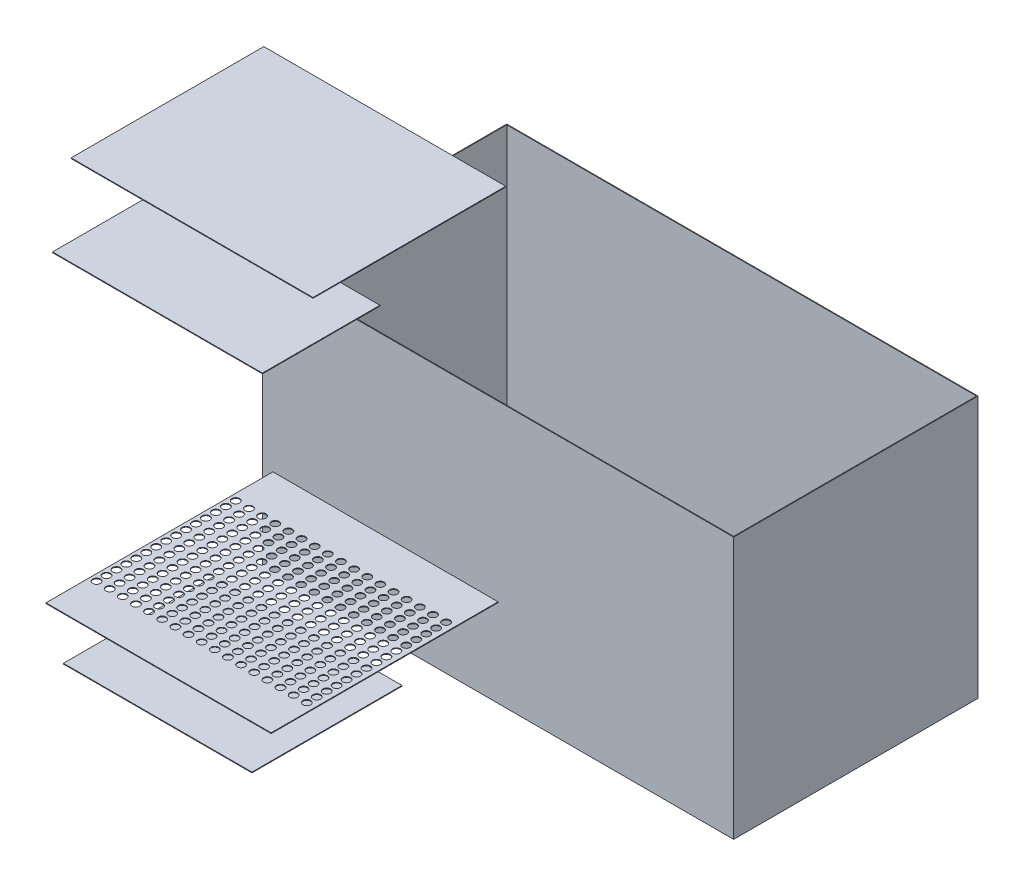
from build123d import *

# Parameters (mm, degrees)
MASTER_FOOTPRINT_W            = 1350
MASTER_FOOTPRINT_H            = 700
BATH_BASE_PLATE_DEPTH         = 750
BATH_SHELL_2MM_T              = -2
INLET_IMPACT_BAFFLE_START     = 125
SKETCH_1_W                    = 540
SKETCH_1_H                    = 430
INLET_IMPACT_BAFFLE_DEPTH     = 2
DISTRIBUTOR_D22_START         = 250
SKETCH_2_W                    = 645
SKETCH_2_H                    = 652
SKETCH_2_R                    = 11
DISTRIBUTOR_D22_DEPTH         = 2
OUTLET_SUBMERGED_BAFFLE_START = 1130
SKETCH_3_W                    = 601.176470588
SKETCH_3_H                    = 336.5
OUTLET_SUBMERGED_BAFFLE_DEPTH = 2
OVERFLOW_WEIR_Z550_START      = 1290
SKETCH_4_W                    = 693
SKETCH_4_H                    = 552
OVERFLOW_WEIR_Z550_DEPTH      = 2


with BuildPart() as part:
    # MASTER_FOOTPRINT → BATH_BASE_PLATE (new body)
    with BuildSketch(Plane(origin=(0, 0, 0), x_dir=(1, 0, 0), z_dir=(0, 1, 0))):
        with Locations((675, 350)):
            Rectangle(MASTER_FOOTPRINT_W, MASTER_FOOTPRINT_H)
    extrude(amount=BATH_BASE_PLATE_DEPTH)

    # BATH_SHELL_2MM
    bath_shell_2mm_openings = [part.faces().sort_by_distance(p)[0] for p in [
        (675, 750, -350),
    ]]
    offset(amount=BATH_SHELL_2MM_T, openings=bath_shell_2mm_openings, kind=Kind.INTERSECTION)


with BuildPart() as body_2:
    # Эскиз1 → INLET_IMPACT_BAFFLE (new body)
    with BuildSketch(Plane(origin=(0, 0, 0), x_dir=(1, 0, 0), z_dir=(0, 1, 0)).offset(INLET_IMPACT_BAFFLE_START)):
        with Locations((350, -435)):
            Rectangle(SKETCH_1_W, SKETCH_1_H)
    extrude(amount=INLET_IMPACT_BAFFLE_DEPTH)


with BuildPart() as body_3:
    # Эскиз2 → DISTRIBUTOR_D22 (new body)
    with BuildSketch(Plane(origin=(0, 0, 0), x_dir=(1, 0, 0), z_dir=(0, 1, 0)).offset(DISTRIBUTOR_D22_START)):
        with Locations((352.5, -324)):
            Rectangle(SKETCH_2_W, SKETCH_2_H)
        with Locations(Location((48.823529412, -125, 0), (0, 0, 270))):
            Circle(SKETCH_2_R, mode=Mode.SUBTRACT)
        with Locations(Location((48.823529412, -153.5, 0), (0, 0, 270))):
            Circle(SKETCH_2_R, mode=Mode.SUBTRACT)
        with Locations(Location((48.823529412, -182, 0), (0, 0, 270))):
            Circle(SKETCH_2_R, mode=Mode.SUBTRACT)
        with Locations(Location((48.823529412, -210.5, 0), (0, 0, 270))):
            Circle(SKETCH_2_R, mode=Mode.SUBTRACT)
        with Locations(Location((48.823529412, -239, 0), (0, 0, 270))):
            Circle(SKETCH_2_R, mode=Mode.SUBTRACT)
        with Locations(Location((48.823529412, -267.5, 0), (0, 0, 270))):
            Circle(SKETCH_2_R, mode=Mode.SUBTRACT)
        with Locations(Location((48.823529412, -296, 0), (0, 0, 270))):
            Circle(SKETCH_2_R, mode=Mode.SUBTRACT)
        with Locations(Location((48.823529412, -324.5, 0), (0, 0, 270))):
            Circle(SKETCH_2_R, mode=Mode.SUBTRACT)
        with Locations(Location((48.823529412, -353, 0), (0, 0, 270))):
            Circle(SKETCH_2_R, mode=Mode.SUBTRACT)
        with Locations(Location((48.823529412, -381.5, 0), (0, 0, 270))):
            Circle(SKETCH_2_R, mode=Mode.SUBTRACT)
        with Locations(Location((48.823529412, -410, 0), (0, 0, 270))):
            Circle(SKETCH_2_R, mode=Mode.SUBTRACT)
        with Locations(Location((48.823529412, -438.5, 0), (0, 0, 270))):
            Circle(SKETCH_2_R, mode=Mode.SUBTRACT)
        with Locations(Location((48.823529412, -467, 0), (0, 0, 270))):
            Circle(SKETCH_2_R, mode=Mode.SUBTRACT)
        with Locations(Location((48.823529412, -495.5, 0), (0, 0, 270))):
            Circle(SKETCH_2_R, mode=Mode.SUBTRACT)
        with Locations(Location((48.823529412, -524, 0), (0, 0, 270))):
            Circle(SKETCH_2_R, mode=Mode.SUBTRACT)
        with Locations(Location((86.470588235, -125, 0), (0, 0, 270))):
            Circle(SKETCH_2_R, mode=Mode.SUBTRACT)
        with Locations(Location((86.470588235, -153.5, 0), (0, 0, 270))):
            Circle(SKETCH_2_R, mode=Mode.SUBTRACT)
        with Locations(Location((86.470588235, -182, 0), (0, 0, 270))):
            Circle(SKETCH_2_R, mode=Mode.SUBTRACT)
        with Locations(Location((86.470588235, -210.5, 0), (0, 0, 270))):
            Circle(SKETCH_2_R, mode=Mode.SUBTRACT)
        with Locations(Location((86.470588235, -239, 0), (0, 0, 270))):
            Circle(SKETCH_2_R, mode=Mode.SUBTRACT)
        with Locations(Location((86.470588235, -267.5, 0), (0, 0, 270))):
            Circle(SKETCH_2_R, mode=Mode.SUBTRACT)
        with Locations(Location((86.470588235, -296, 0), (0, 0, 270))):
            Circle(SKETCH_2_R, mode=Mode.SUBTRACT)
        with Locations(Location((86.470588235, -324.5, 0), (0, 0, 270))):
            Circle(SKETCH_2_R, mode=Mode.SUBTRACT)
        with Locations(Location((86.470588235, -353, 0), (0, 0, 270))):
            Circle(SKETCH_2_R, mode=Mode.SUBTRACT)
        with Locations(Location((86.470588235, -381.5, 0), (0, 0, 270))):
            Circle(SKETCH_2_R, mode=Mode.SUBTRACT)
        with Locations(Location((86.470588235, -410, 0), (0, 0, 270))):
            Circle(SKETCH_2_R, mode=Mode.SUBTRACT)
        with Locations(Location((86.470588235, -438.5, 0), (0, 0, 270))):
            Circle(SKETCH_2_R, mode=Mode.SUBTRACT)
        with Locations(Location((86.470588235, -467, 0), (0, 0, 270))):
            Circle(SKETCH_2_R, mode=Mode.SUBTRACT)
        with Locations(Location((86.470588235, -495.5, 0), (0, 0, 270))):
            Circle(SKETCH_2_R, mode=Mode.SUBTRACT)
        with Locations(Location((86.470588235, -524, 0), (0, 0, 270))):
            Circle(SKETCH_2_R, mode=Mode.SUBTRACT)
        with Locations(Location((124.117647059, -125, 0), (0, 0, 270))):
            Circle(SKETCH_2_R, mode=Mode.SUBTRACT)
        with Locations(Location((124.117647059, -153.5, 0), (0, 0, 270))):
            Circle(SKETCH_2_R, mode=Mode.SUBTRACT)
        with Locations(Location((124.117647059, -182, 0), (0, 0, 270))):
            Circle(SKETCH_2_R, mode=Mode.SUBTRACT)
        with Locations(Location((124.117647059, -210.5, 0), (0, 0, 270))):
            Circle(SKETCH_2_R, mode=Mode.SUBTRACT)
        with Locations(Location((124.117647059, -239, 0), (0, 0, 270))):
            Circle(SKETCH_2_R, mode=Mode.SUBTRACT)
        with Locations(Location((124.117647059, -267.5, 0), (0, 0, 270))):
            Circle(SKETCH_2_R, mode=Mode.SUBTRACT)
        with Locations(Location((124.117647059, -296, 0), (0, 0, 270))):
            Circle(SKETCH_2_R, mode=Mode.SUBTRACT)
        with Locations(Location((124.117647059, -324.5, 0), (0, 0, 270))):
            Circle(SKETCH_2_R, mode=Mode.SUBTRACT)
        with Locations(Location((124.117647059, -353, 0), (0, 0, 270))):
            Circle(SKETCH_2_R, mode=Mode.SUBTRACT)
        with Locations(Location((124.117647059, -381.5, 0), (0, 0, 270))):
            Circle(SKETCH_2_R, mode=Mode.SUBTRACT)
        with Locations(Location((124.117647059, -410, 0), (0, 0, 270))):
            Circle(SKETCH_2_R, mode=Mode.SUBTRACT)
        with Locations(Location((124.117647059, -438.5, 0), (0, 0, 270))):
            Circle(SKETCH_2_R, mode=Mode.SUBTRACT)
        with Locations(Location((124.117647059, -467, 0), (0, 0, 270))):
            Circle(SKETCH_2_R, mode=Mode.SUBTRACT)
        with Locations(Location((124.117647059, -495.5, 0), (0, 0, 270))):
            Circle(SKETCH_2_R, mode=Mode.SUBTRACT)
        with Locations(Location((124.117647059, -524, 0), (0, 0, 270))):
            Circle(SKETCH_2_R, mode=Mode.SUBTRACT)
        with Locations(Location((161.764705882, -125, 0), (0, 0, 270))):
            Circle(SKETCH_2_R, mode=Mode.SUBTRACT)
        with Locations(Location((161.764705882, -153.5, 0), (0, 0, 270))):
            Circle(SKETCH_2_R, mode=Mode.SUBTRACT)
        with Locations(Location((161.764705882, -182, 0), (0, 0, 270))):
            Circle(SKETCH_2_R, mode=Mode.SUBTRACT)
        with Locations(Location((161.764705882, -210.5, 0), (0, 0, 270))):
            Circle(SKETCH_2_R, mode=Mode.SUBTRACT)
        with Locations(Location((161.764705882, -239, 0), (0, 0, 270))):
            Circle(SKETCH_2_R, mode=Mode.SUBTRACT)
        with Locations(Location((161.764705882, -267.5, 0), (0, 0, 270))):
            Circle(SKETCH_2_R, mode=Mode.SUBTRACT)
        with Locations(Location((161.764705882, -296, 0), (0, 0, 270))):
            Circle(SKETCH_2_R, mode=Mode.SUBTRACT)
        with Locations(Location((161.764705882, -324.5, 0), (0, 0, 270))):
            Circle(SKETCH_2_R, mode=Mode.SUBTRACT)
        with Locations(Location((161.764705882, -353, 0), (0, 0, 270))):
            Circle(SKETCH_2_R, mode=Mode.SUBTRACT)
        with Locations(Location((161.764705882, -381.5, 0), (0, 0, 270))):
            Circle(SKETCH_2_R, mode=Mode.SUBTRACT)
        with Locations(Location((161.764705882, -410, 0), (0, 0, 270))):
            Circle(SKETCH_2_R, mode=Mode.SUBTRACT)
        with Locations(Location((161.764705882, -438.5, 0), (0, 0, 270))):
            Circle(SKETCH_2_R, mode=Mode.SUBTRACT)
        with Locations(Location((161.764705882, -467, 0), (0, 0, 270))):
            Circle(SKETCH_2_R, mode=Mode.SUBTRACT)
        with Locations(Location((161.764705882, -495.5, 0), (0, 0, 270))):
            Circle(SKETCH_2_R, mode=Mode.SUBTRACT)
        with Locations(Location((161.764705882, -524, 0), (0, 0, 270))):
            Circle(SKETCH_2_R, mode=Mode.SUBTRACT)
        with Locations(Location((199.411764706, -125, 0), (0, 0, 270))):
            Circle(SKETCH_2_R, mode=Mode.SUBTRACT)
        with Locations(Location((199.411764706, -153.5, 0), (0, 0, 270))):
            Circle(SKETCH_2_R, mode=Mode.SUBTRACT)
        with Locations(Location((199.411764706, -182, 0), (0, 0, 270))):
            Circle(SKETCH_2_R, mode=Mode.SUBTRACT)
        with Locations(Location((199.411764706, -210.5, 0), (0, 0, 270))):
            Circle(SKETCH_2_R, mode=Mode.SUBTRACT)
        with Locations(Location((199.411764706, -239, 0), (0, 0, 270))):
            Circle(SKETCH_2_R, mode=Mode.SUBTRACT)
        with Locations(Location((199.411764706, -267.5, 0), (0, 0, 270))):
            Circle(SKETCH_2_R, mode=Mode.SUBTRACT)
        with Locations(Location((199.411764706, -296, 0), (0, 0, 270))):
            Circle(SKETCH_2_R, mode=Mode.SUBTRACT)
        with Locations(Location((199.411764706, -324.5, 0), (0, 0, 270))):
            Circle(SKETCH_2_R, mode=Mode.SUBTRACT)
        with Locations(Location((199.411764706, -353, 0), (0, 0, 270))):
            Circle(SKETCH_2_R, mode=Mode.SUBTRACT)
        with Locations(Location((199.411764706, -381.5, 0), (0, 0, 270))):
            Circle(SKETCH_2_R, mode=Mode.SUBTRACT)
        with Locations(Location((199.411764706, -410, 0), (0, 0, 270))):
            Circle(SKETCH_2_R, mode=Mode.SUBTRACT)
        with Locations(Location((199.411764706, -438.5, 0), (0, 0, 270))):
            Circle(SKETCH_2_R, mode=Mode.SUBTRACT)
        with Locations(Location((199.411764706, -467, 0), (0, 0, 270))):
            Circle(SKETCH_2_R, mode=Mode.SUBTRACT)
        with Locations(Location((199.411764706, -495.5, 0), (0, 0, 270))):
            Circle(SKETCH_2_R, mode=Mode.SUBTRACT)
        with Locations(Location((199.411764706, -524, 0), (0, 0, 270))):
            Circle(SKETCH_2_R, mode=Mode.SUBTRACT)
        with Locations(Location((237.058823529, -125, 0), (0, 0, 270))):
            Circle(SKETCH_2_R, mode=Mode.SUBTRACT)
        with Locations(Location((237.058823529, -153.5, 0), (0, 0, 270))):
            Circle(SKETCH_2_R, mode=Mode.SUBTRACT)
        with Locations(Location((237.058823529, -182, 0), (0, 0, 270))):
            Circle(SKETCH_2_R, mode=Mode.SUBTRACT)
        with Locations(Location((237.058823529, -210.5, 0), (0, 0, 270))):
            Circle(SKETCH_2_R, mode=Mode.SUBTRACT)
        with Locations(Location((237.058823529, -239, 0), (0, 0, 270))):
            Circle(SKETCH_2_R, mode=Mode.SUBTRACT)
        with Locations(Location((237.058823529, -267.5, 0), (0, 0, 270))):
            Circle(SKETCH_2_R, mode=Mode.SUBTRACT)
        with Locations(Location((237.058823529, -296, 0), (0, 0, 270))):
            Circle(SKETCH_2_R, mode=Mode.SUBTRACT)
        with Locations(Location((237.058823529, -324.5, 0), (0, 0, 270))):
            Circle(SKETCH_2_R, mode=Mode.SUBTRACT)
        with Locations(Location((237.058823529, -353, 0), (0, 0, 270))):
            Circle(SKETCH_2_R, mode=Mode.SUBTRACT)
        with Locations(Location((237.058823529, -381.5, 0), (0, 0, 270))):
            Circle(SKETCH_2_R, mode=Mode.SUBTRACT)
        with Locations(Location((237.058823529, -410, 0), (0, 0, 270))):
            Circle(SKETCH_2_R, mode=Mode.SUBTRACT)
        with Locations(Location((237.058823529, -438.5, 0), (0, 0, 270))):
            Circle(SKETCH_2_R, mode=Mode.SUBTRACT)
        with Locations(Location((237.058823529, -467, 0), (0, 0, 270))):
            Circle(SKETCH_2_R, mode=Mode.SUBTRACT)
        with Locations(Location((237.058823529, -495.5, 0), (0, 0, 270))):
            Circle(SKETCH_2_R, mode=Mode.SUBTRACT)
        with Locations(Location((237.058823529, -524, 0), (0, 0, 270))):
            Circle(SKETCH_2_R, mode=Mode.SUBTRACT)
        with Locations(Location((274.705882353, -125, 0), (0, 0, 270))):
            Circle(SKETCH_2_R, mode=Mode.SUBTRACT)
        with Locations(Location((274.705882353, -153.5, 0), (0, 0, 270))):
            Circle(SKETCH_2_R, mode=Mode.SUBTRACT)
        with Locations(Location((274.705882353, -182, 0), (0, 0, 270))):
            Circle(SKETCH_2_R, mode=Mode.SUBTRACT)
        with Locations(Location((274.705882353, -210.5, 0), (0, 0, 270))):
            Circle(SKETCH_2_R, mode=Mode.SUBTRACT)
        with Locations(Location((274.705882353, -239, 0), (0, 0, 270))):
            Circle(SKETCH_2_R, mode=Mode.SUBTRACT)
        with Locations(Location((274.705882353, -267.5, 0), (0, 0, 270))):
            Circle(SKETCH_2_R, mode=Mode.SUBTRACT)
        with Locations(Location((274.705882353, -296, 0), (0, 0, 270))):
            Circle(SKETCH_2_R, mode=Mode.SUBTRACT)
        with Locations(Location((274.705882353, -324.5, 0), (0, 0, 270))):
            Circle(SKETCH_2_R, mode=Mode.SUBTRACT)
        with Locations(Location((274.705882353, -353, 0), (0, 0, 270))):
            Circle(SKETCH_2_R, mode=Mode.SUBTRACT)
        with Locations(Location((274.705882353, -381.5, 0), (0, 0, 270))):
            Circle(SKETCH_2_R, mode=Mode.SUBTRACT)
        with Locations(Location((274.705882353, -410, 0), (0, 0, 270))):
            Circle(SKETCH_2_R, mode=Mode.SUBTRACT)
        with Locations(Location((274.705882353, -438.5, 0), (0, 0, 270))):
            Circle(SKETCH_2_R, mode=Mode.SUBTRACT)
        with Locations(Location((274.705882353, -467, 0), (0, 0, 270))):
            Circle(SKETCH_2_R, mode=Mode.SUBTRACT)
        with Locations(Location((274.705882353, -495.5, 0), (0, 0, 270))):
            Circle(SKETCH_2_R, mode=Mode.SUBTRACT)
        with Locations(Location((274.705882353, -524, 0), (0, 0, 270))):
            Circle(SKETCH_2_R, mode=Mode.SUBTRACT)
        with Locations(Location((312.352941176, -125, 0), (0, 0, 270))):
            Circle(SKETCH_2_R, mode=Mode.SUBTRACT)
        with Locations(Location((312.352941176, -153.5, 0), (0, 0, 270))):
            Circle(SKETCH_2_R, mode=Mode.SUBTRACT)
        with Locations(Location((312.352941176, -182, 0), (0, 0, 270))):
            Circle(SKETCH_2_R, mode=Mode.SUBTRACT)
        with Locations(Location((312.352941176, -210.5, 0), (0, 0, 270))):
            Circle(SKETCH_2_R, mode=Mode.SUBTRACT)
        with Locations(Location((312.352941176, -239, 0), (0, 0, 270))):
            Circle(SKETCH_2_R, mode=Mode.SUBTRACT)
        with Locations(Location((312.352941176, -267.5, 0), (0, 0, 270))):
            Circle(SKETCH_2_R, mode=Mode.SUBTRACT)
        with Locations(Location((312.352941176, -296, 0), (0, 0, 270))):
            Circle(SKETCH_2_R, mode=Mode.SUBTRACT)
        with Locations(Location((312.352941176, -324.5, 0), (0, 0, 270))):
            Circle(SKETCH_2_R, mode=Mode.SUBTRACT)
        with Locations(Location((312.352941176, -353, 0), (0, 0, 270))):
            Circle(SKETCH_2_R, mode=Mode.SUBTRACT)
        with Locations(Location((312.352941176, -381.5, 0), (0, 0, 270))):
            Circle(SKETCH_2_R, mode=Mode.SUBTRACT)
        with Locations(Location((312.352941176, -410, 0), (0, 0, 270))):
            Circle(SKETCH_2_R, mode=Mode.SUBTRACT)
        with Locations(Location((312.352941176, -438.5, 0), (0, 0, 270))):
            Circle(SKETCH_2_R, mode=Mode.SUBTRACT)
        with Locations(Location((312.352941176, -467, 0), (0, 0, 270))):
            Circle(SKETCH_2_R, mode=Mode.SUBTRACT)
        with Locations(Location((312.352941176, -495.5, 0), (0, 0, 270))):
            Circle(SKETCH_2_R, mode=Mode.SUBTRACT)
        with Locations(Location((312.352941176, -524, 0), (0, 0, 270))):
            Circle(SKETCH_2_R, mode=Mode.SUBTRACT)
        with Locations(Location((350, -125, 0), (0, 0, 270))):
            Circle(SKETCH_2_R, mode=Mode.SUBTRACT)
        with Locations(Location((350, -153.5, 0), (0, 0, 270))):
            Circle(SKETCH_2_R, mode=Mode.SUBTRACT)
        with Locations(Location((350, -182, 0), (0, 0, 270))):
            Circle(SKETCH_2_R, mode=Mode.SUBTRACT)
        with Locations(Location((350, -210.5, 0), (0, 0, 270))):
            Circle(SKETCH_2_R, mode=Mode.SUBTRACT)
        with Locations(Location((350, -239, 0), (0, 0, 270))):
            Circle(SKETCH_2_R, mode=Mode.SUBTRACT)
        with Locations(Location((350, -267.5, 0), (0, 0, 270))):
            Circle(SKETCH_2_R, mode=Mode.SUBTRACT)
        with Locations(Location((350, -296, 0), (0, 0, 270))):
            Circle(SKETCH_2_R, mode=Mode.SUBTRACT)
        with Locations(Location((350, -324.5, 0), (0, 0, 270))):
            Circle(SKETCH_2_R, mode=Mode.SUBTRACT)
        with Locations(Location((350, -353, 0), (0, 0, 270))):
            Circle(SKETCH_2_R, mode=Mode.SUBTRACT)
        with Locations(Location((350, -381.5, 0), (0, 0, 270))):
            Circle(SKETCH_2_R, mode=Mode.SUBTRACT)
        with Locations(Location((350, -410, 0), (0, 0, 270))):
            Circle(SKETCH_2_R, mode=Mode.SUBTRACT)
        with Locations(Location((350, -438.5, 0), (0, 0, 270))):
            Circle(SKETCH_2_R, mode=Mode.SUBTRACT)
        with Locations(Location((350, -467, 0), (0, 0, 270))):
            Circle(SKETCH_2_R, mode=Mode.SUBTRACT)
        with Locations(Location((350, -495.5, 0), (0, 0, 270))):
            Circle(SKETCH_2_R, mode=Mode.SUBTRACT)
        with Locations(Location((350, -524, 0), (0, 0, 270))):
            Circle(SKETCH_2_R, mode=Mode.SUBTRACT)
        with Locations(Location((387.647058824, -125, 0), (0, 0, 270))):
            Circle(SKETCH_2_R, mode=Mode.SUBTRACT)
        with Locations(Location((387.647058824, -153.5, 0), (0, 0, 270))):
            Circle(SKETCH_2_R, mode=Mode.SUBTRACT)
        with Locations(Location((387.647058824, -182, 0), (0, 0, 270))):
            Circle(SKETCH_2_R, mode=Mode.SUBTRACT)
        with Locations(Location((387.647058824, -210.5, 0), (0, 0, 270))):
            Circle(SKETCH_2_R, mode=Mode.SUBTRACT)
        with Locations(Location((387.647058824, -239, 0), (0, 0, 270))):
            Circle(SKETCH_2_R, mode=Mode.SUBTRACT)
        with Locations(Location((387.647058824, -267.5, 0), (0, 0, 270))):
            Circle(SKETCH_2_R, mode=Mode.SUBTRACT)
        with Locations(Location((387.647058824, -296, 0), (0, 0, 270))):
            Circle(SKETCH_2_R, mode=Mode.SUBTRACT)
        with Locations(Location((387.647058824, -324.5, 0), (0, 0, 270))):
            Circle(SKETCH_2_R, mode=Mode.SUBTRACT)
        with Locations(Location((387.647058824, -353, 0), (0, 0, 270))):
            Circle(SKETCH_2_R, mode=Mode.SUBTRACT)
        with Locations(Location((387.647058824, -381.5, 0), (0, 0, 270))):
            Circle(SKETCH_2_R, mode=Mode.SUBTRACT)
        with Locations(Location((387.647058824, -410, 0), (0, 0, 270))):
            Circle(SKETCH_2_R, mode=Mode.SUBTRACT)
        with Locations(Location((387.647058824, -438.5, 0), (0, 0, 270))):
            Circle(SKETCH_2_R, mode=Mode.SUBTRACT)
        with Locations(Location((387.647058824, -467, 0), (0, 0, 270))):
            Circle(SKETCH_2_R, mode=Mode.SUBTRACT)
        with Locations(Location((387.647058824, -495.5, 0), (0, 0, 270))):
            Circle(SKETCH_2_R, mode=Mode.SUBTRACT)
        with Locations(Location((387.647058824, -524, 0), (0, 0, 270))):
            Circle(SKETCH_2_R, mode=Mode.SUBTRACT)
        with Locations(Location((425.294117647, -125, 0), (0, 0, 270))):
            Circle(SKETCH_2_R, mode=Mode.SUBTRACT)
        with Locations(Location((425.294117647, -153.5, 0), (0, 0, 270))):
            Circle(SKETCH_2_R, mode=Mode.SUBTRACT)
        with Locations(Location((425.294117647, -182, 0), (0, 0, 270))):
            Circle(SKETCH_2_R, mode=Mode.SUBTRACT)
        with Locations(Location((425.294117647, -210.5, 0), (0, 0, 270))):
            Circle(SKETCH_2_R, mode=Mode.SUBTRACT)
        with Locations(Location((425.294117647, -239, 0), (0, 0, 270))):
            Circle(SKETCH_2_R, mode=Mode.SUBTRACT)
        with Locations(Location((425.294117647, -267.5, 0), (0, 0, 270))):
            Circle(SKETCH_2_R, mode=Mode.SUBTRACT)
        with Locations(Location((425.294117647, -296, 0), (0, 0, 270))):
            Circle(SKETCH_2_R, mode=Mode.SUBTRACT)
        with Locations(Location((425.294117647, -324.5, 0), (0, 0, 270))):
            Circle(SKETCH_2_R, mode=Mode.SUBTRACT)
        with Locations(Location((425.294117647, -353, 0), (0, 0, 270))):
            Circle(SKETCH_2_R, mode=Mode.SUBTRACT)
        with Locations(Location((425.294117647, -381.5, 0), (0, 0, 270))):
            Circle(SKETCH_2_R, mode=Mode.SUBTRACT)
        with Locations(Location((425.294117647, -410, 0), (0, 0, 270))):
            Circle(SKETCH_2_R, mode=Mode.SUBTRACT)
        with Locations(Location((425.294117647, -438.5, 0), (0, 0, 270))):
            Circle(SKETCH_2_R, mode=Mode.SUBTRACT)
        with Locations(Location((425.294117647, -467, 0), (0, 0, 270))):
            Circle(SKETCH_2_R, mode=Mode.SUBTRACT)
        with Locations(Location((425.294117647, -495.5, 0), (0, 0, 270))):
            Circle(SKETCH_2_R, mode=Mode.SUBTRACT)
        with Locations(Location((425.294117647, -524, 0), (0, 0, 270))):
            Circle(SKETCH_2_R, mode=Mode.SUBTRACT)
        with Locations(Location((462.941176471, -125, 0), (0, 0, 270))):
            Circle(SKETCH_2_R, mode=Mode.SUBTRACT)
        with Locations(Location((462.941176471, -153.5, 0), (0, 0, 270))):
            Circle(SKETCH_2_R, mode=Mode.SUBTRACT)
        with Locations(Location((462.941176471, -182, 0), (0, 0, 270))):
            Circle(SKETCH_2_R, mode=Mode.SUBTRACT)
        with Locations(Location((462.941176471, -210.5, 0), (0, 0, 270))):
            Circle(SKETCH_2_R, mode=Mode.SUBTRACT)
        with Locations(Location((462.941176471, -239, 0), (0, 0, 270))):
            Circle(SKETCH_2_R, mode=Mode.SUBTRACT)
        with Locations(Location((462.941176471, -267.5, 0), (0, 0, 270))):
            Circle(SKETCH_2_R, mode=Mode.SUBTRACT)
        with Locations(Location((462.941176471, -296, 0), (0, 0, 270))):
            Circle(SKETCH_2_R, mode=Mode.SUBTRACT)
        with Locations(Location((462.941176471, -324.5, 0), (0, 0, 270))):
            Circle(SKETCH_2_R, mode=Mode.SUBTRACT)
        with Locations(Location((462.941176471, -353, 0), (0, 0, 270))):
            Circle(SKETCH_2_R, mode=Mode.SUBTRACT)
        with Locations(Location((462.941176471, -381.5, 0), (0, 0, 270))):
            Circle(SKETCH_2_R, mode=Mode.SUBTRACT)
        with Locations(Location((462.941176471, -410, 0), (0, 0, 270))):
            Circle(SKETCH_2_R, mode=Mode.SUBTRACT)
        with Locations(Location((462.941176471, -438.5, 0), (0, 0, 270))):
            Circle(SKETCH_2_R, mode=Mode.SUBTRACT)
        with Locations(Location((462.941176471, -467, 0), (0, 0, 270))):
            Circle(SKETCH_2_R, mode=Mode.SUBTRACT)
        with Locations(Location((462.941176471, -495.5, 0), (0, 0, 270))):
            Circle(SKETCH_2_R, mode=Mode.SUBTRACT)
        with Locations(Location((462.941176471, -524, 0), (0, 0, 270))):
            Circle(SKETCH_2_R, mode=Mode.SUBTRACT)
        with Locations(Location((500.588235294, -125, 0), (0, 0, 270))):
            Circle(SKETCH_2_R, mode=Mode.SUBTRACT)
        with Locations(Location((500.588235294, -153.5, 0), (0, 0, 270))):
            Circle(SKETCH_2_R, mode=Mode.SUBTRACT)
        with Locations(Location((500.588235294, -182, 0), (0, 0, 270))):
            Circle(SKETCH_2_R, mode=Mode.SUBTRACT)
        with Locations(Location((500.588235294, -210.5, 0), (0, 0, 270))):
            Circle(SKETCH_2_R, mode=Mode.SUBTRACT)
        with Locations(Location((500.588235294, -239, 0), (0, 0, 270))):
            Circle(SKETCH_2_R, mode=Mode.SUBTRACT)
        with Locations(Location((500.588235294, -267.5, 0), (0, 0, 270))):
            Circle(SKETCH_2_R, mode=Mode.SUBTRACT)
        with Locations(Location((500.588235294, -296, 0), (0, 0, 270))):
            Circle(SKETCH_2_R, mode=Mode.SUBTRACT)
        with Locations(Location((500.588235294, -324.5, 0), (0, 0, 270))):
            Circle(SKETCH_2_R, mode=Mode.SUBTRACT)
        with Locations(Location((500.588235294, -353, 0), (0, 0, 270))):
            Circle(SKETCH_2_R, mode=Mode.SUBTRACT)
        with Locations(Location((500.588235294, -381.5, 0), (0, 0, 270))):
            Circle(SKETCH_2_R, mode=Mode.SUBTRACT)
        with Locations(Location((500.588235294, -410, 0), (0, 0, 270))):
            Circle(SKETCH_2_R, mode=Mode.SUBTRACT)
        with Locations(Location((500.588235294, -438.5, 0), (0, 0, 270))):
            Circle(SKETCH_2_R, mode=Mode.SUBTRACT)
        with Locations(Location((500.588235294, -467, 0), (0, 0, 270))):
            Circle(SKETCH_2_R, mode=Mode.SUBTRACT)
        with Locations(Location((500.588235294, -495.5, 0), (0, 0, 270))):
            Circle(SKETCH_2_R, mode=Mode.SUBTRACT)
        with Locations(Location((500.588235294, -524, 0), (0, 0, 270))):
            Circle(SKETCH_2_R, mode=Mode.SUBTRACT)
        with Locations(Location((538.235294118, -125, 0), (0, 0, 270))):
            Circle(SKETCH_2_R, mode=Mode.SUBTRACT)
        with Locations(Location((538.235294118, -153.5, 0), (0, 0, 270))):
            Circle(SKETCH_2_R, mode=Mode.SUBTRACT)
        with Locations(Location((538.235294118, -182, 0), (0, 0, 270))):
            Circle(SKETCH_2_R, mode=Mode.SUBTRACT)
        with Locations(Location((538.235294118, -210.5, 0), (0, 0, 270))):
            Circle(SKETCH_2_R, mode=Mode.SUBTRACT)
        with Locations(Location((538.235294118, -239, 0), (0, 0, 270))):
            Circle(SKETCH_2_R, mode=Mode.SUBTRACT)
        with Locations(Location((538.235294118, -267.5, 0), (0, 0, 270))):
            Circle(SKETCH_2_R, mode=Mode.SUBTRACT)
        with Locations(Location((538.235294118, -296, 0), (0, 0, 270))):
            Circle(SKETCH_2_R, mode=Mode.SUBTRACT)
        with Locations(Location((538.235294118, -324.5, 0), (0, 0, 270))):
            Circle(SKETCH_2_R, mode=Mode.SUBTRACT)
        with Locations(Location((538.235294118, -353, 0), (0, 0, 270))):
            Circle(SKETCH_2_R, mode=Mode.SUBTRACT)
        with Locations(Location((538.235294118, -381.5, 0), (0, 0, 270))):
            Circle(SKETCH_2_R, mode=Mode.SUBTRACT)
        with Locations(Location((538.235294118, -410, 0), (0, 0, 270))):
            Circle(SKETCH_2_R, mode=Mode.SUBTRACT)
        with Locations(Location((538.235294118, -438.5, 0), (0, 0, 270))):
            Circle(SKETCH_2_R, mode=Mode.SUBTRACT)
        with Locations(Location((538.235294118, -467, 0), (0, 0, 270))):
            Circle(SKETCH_2_R, mode=Mode.SUBTRACT)
        with Locations(Location((538.235294118, -495.5, 0), (0, 0, 270))):
            Circle(SKETCH_2_R, mode=Mode.SUBTRACT)
        with Locations(Location((538.235294118, -524, 0), (0, 0, 270))):
            Circle(SKETCH_2_R, mode=Mode.SUBTRACT)
        with Locations(Location((575.882352941, -125, 0), (0, 0, 270))):
            Circle(SKETCH_2_R, mode=Mode.SUBTRACT)
        with Locations(Location((575.882352941, -153.5, 0), (0, 0, 270))):
            Circle(SKETCH_2_R, mode=Mode.SUBTRACT)
        with Locations(Location((575.882352941, -182, 0), (0, 0, 270))):
            Circle(SKETCH_2_R, mode=Mode.SUBTRACT)
        with Locations(Location((575.882352941, -210.5, 0), (0, 0, 270))):
            Circle(SKETCH_2_R, mode=Mode.SUBTRACT)
        with Locations(Location((575.882352941, -239, 0), (0, 0, 270))):
            Circle(SKETCH_2_R, mode=Mode.SUBTRACT)
        with Locations(Location((575.882352941, -267.5, 0), (0, 0, 270))):
            Circle(SKETCH_2_R, mode=Mode.SUBTRACT)
        with Locations(Location((575.882352941, -296, 0), (0, 0, 270))):
            Circle(SKETCH_2_R, mode=Mode.SUBTRACT)
        with Locations(Location((575.882352941, -324.5, 0), (0, 0, 270))):
            Circle(SKETCH_2_R, mode=Mode.SUBTRACT)
        with Locations(Location((575.882352941, -353, 0), (0, 0, 270))):
            Circle(SKETCH_2_R, mode=Mode.SUBTRACT)
        with Locations(Location((575.882352941, -381.5, 0), (0, 0, 270))):
            Circle(SKETCH_2_R, mode=Mode.SUBTRACT)
        with Locations(Location((575.882352941, -410, 0), (0, 0, 270))):
            Circle(SKETCH_2_R, mode=Mode.SUBTRACT)
        with Locations(Location((575.882352941, -438.5, 0), (0, 0, 270))):
            Circle(SKETCH_2_R, mode=Mode.SUBTRACT)
        with Locations(Location((575.882352941, -467, 0), (0, 0, 270))):
            Circle(SKETCH_2_R, mode=Mode.SUBTRACT)
        with Locations(Location((575.882352941, -495.5, 0), (0, 0, 270))):
            Circle(SKETCH_2_R, mode=Mode.SUBTRACT)
        with Locations(Location((575.882352941, -524, 0), (0, 0, 270))):
            Circle(SKETCH_2_R, mode=Mode.SUBTRACT)
        with Locations(Location((613.529411765, -125, 0), (0, 0, 270))):
            Circle(SKETCH_2_R, mode=Mode.SUBTRACT)
        with Locations(Location((613.529411765, -153.5, 0), (0, 0, 270))):
            Circle(SKETCH_2_R, mode=Mode.SUBTRACT)
        with Locations(Location((613.529411765, -182, 0), (0, 0, 270))):
            Circle(SKETCH_2_R, mode=Mode.SUBTRACT)
        with Locations(Location((613.529411765, -210.5, 0), (0, 0, 270))):
            Circle(SKETCH_2_R, mode=Mode.SUBTRACT)
        with Locations(Location((613.529411765, -239, 0), (0, 0, 270))):
            Circle(SKETCH_2_R, mode=Mode.SUBTRACT)
        with Locations(Location((613.529411765, -267.5, 0), (0, 0, 270))):
            Circle(SKETCH_2_R, mode=Mode.SUBTRACT)
        with Locations(Location((613.529411765, -296, 0), (0, 0, 270))):
            Circle(SKETCH_2_R, mode=Mode.SUBTRACT)
        with Locations(Location((613.529411765, -324.5, 0), (0, 0, 270))):
            Circle(SKETCH_2_R, mode=Mode.SUBTRACT)
        with Locations(Location((613.529411765, -353, 0), (0, 0, 270))):
            Circle(SKETCH_2_R, mode=Mode.SUBTRACT)
        with Locations(Location((613.529411765, -381.5, 0), (0, 0, 270))):
            Circle(SKETCH_2_R, mode=Mode.SUBTRACT)
        with Locations(Location((613.529411765, -410, 0), (0, 0, 270))):
            Circle(SKETCH_2_R, mode=Mode.SUBTRACT)
        with Locations(Location((613.529411765, -438.5, 0), (0, 0, 270))):
            Circle(SKETCH_2_R, mode=Mode.SUBTRACT)
        with Locations(Location((613.529411765, -467, 0), (0, 0, 270))):
            Circle(SKETCH_2_R, mode=Mode.SUBTRACT)
        with Locations(Location((613.529411765, -495.5, 0), (0, 0, 270))):
            Circle(SKETCH_2_R, mode=Mode.SUBTRACT)
        with Locations(Location((613.529411765, -524, 0), (0, 0, 270))):
            Circle(SKETCH_2_R, mode=Mode.SUBTRACT)
        with Locations(Location((651.176470588, -125, 0), (0, 0, 270))):
            Circle(SKETCH_2_R, mode=Mode.SUBTRACT)
        with Locations(Location((651.176470588, -153.5, 0), (0, 0, 270))):
            Circle(SKETCH_2_R, mode=Mode.SUBTRACT)
        with Locations(Location((651.176470588, -182, 0), (0, 0, 270))):
            Circle(SKETCH_2_R, mode=Mode.SUBTRACT)
        with Locations(Location((651.176470588, -210.5, 0), (0, 0, 270))):
            Circle(SKETCH_2_R, mode=Mode.SUBTRACT)
        with Locations(Location((651.176470588, -239, 0), (0, 0, 270))):
            Circle(SKETCH_2_R, mode=Mode.SUBTRACT)
        with Locations(Location((651.176470588, -267.5, 0), (0, 0, 270))):
            Circle(SKETCH_2_R, mode=Mode.SUBTRACT)
        with Locations(Location((651.176470588, -296, 0), (0, 0, 270))):
            Circle(SKETCH_2_R, mode=Mode.SUBTRACT)
        with Locations(Location((651.176470588, -324.5, 0), (0, 0, 270))):
            Circle(SKETCH_2_R, mode=Mode.SUBTRACT)
        with Locations(Location((651.176470588, -353, 0), (0, 0, 270))):
            Circle(SKETCH_2_R, mode=Mode.SUBTRACT)
        with Locations(Location((651.176470588, -381.5, 0), (0, 0, 270))):
            Circle(SKETCH_2_R, mode=Mode.SUBTRACT)
        with Locations(Location((651.176470588, -410, 0), (0, 0, 270))):
            Circle(SKETCH_2_R, mode=Mode.SUBTRACT)
        with Locations(Location((651.176470588, -438.5, 0), (0, 0, 270))):
            Circle(SKETCH_2_R, mode=Mode.SUBTRACT)
        with Locations(Location((651.176470588, -467, 0), (0, 0, 270))):
            Circle(SKETCH_2_R, mode=Mode.SUBTRACT)
        with Locations(Location((651.176470588, -495.5, 0), (0, 0, 270))):
            Circle(SKETCH_2_R, mode=Mode.SUBTRACT)
        with Locations(Location((651.176470588, -524, 0), (0, 0, 270))):
            Circle(SKETCH_2_R, mode=Mode.SUBTRACT)
    extrude(amount=DISTRIBUTOR_D22_DEPTH)


with BuildPart() as body_4:
    # Эскиз3 → OUTLET_SUBMERGED_BAFFLE (new body)
    with BuildSketch(Plane(origin=(0, 0, 0), x_dir=(1, 0, 0), z_dir=(0, 1, 0)).offset(OUTLET_SUBMERGED_BAFFLE_START)):
        with Locations((349.411764706, -481.75)):
            Rectangle(SKETCH_3_W, SKETCH_3_H)
    extrude(amount=OUTLET_SUBMERGED_BAFFLE_DEPTH)


with BuildPart() as body_5:
    # Эскиз4 → OVERFLOW_WEIR_Z550 (new body)
    with BuildSketch(Plane(origin=(0, 0, 0), x_dir=(1, 0, 0), z_dir=(0, 1, 0)).offset(OVERFLOW_WEIR_Z550_START)):
        with Locations((348.5, -274)):
            Rectangle(SKETCH_4_W, SKETCH_4_H)
    extrude(amount=OVERFLOW_WEIR_Z550_DEPTH)


solid = Compound([part.part, body_2.part, body_3.part, body_4.part, body_5.part])
